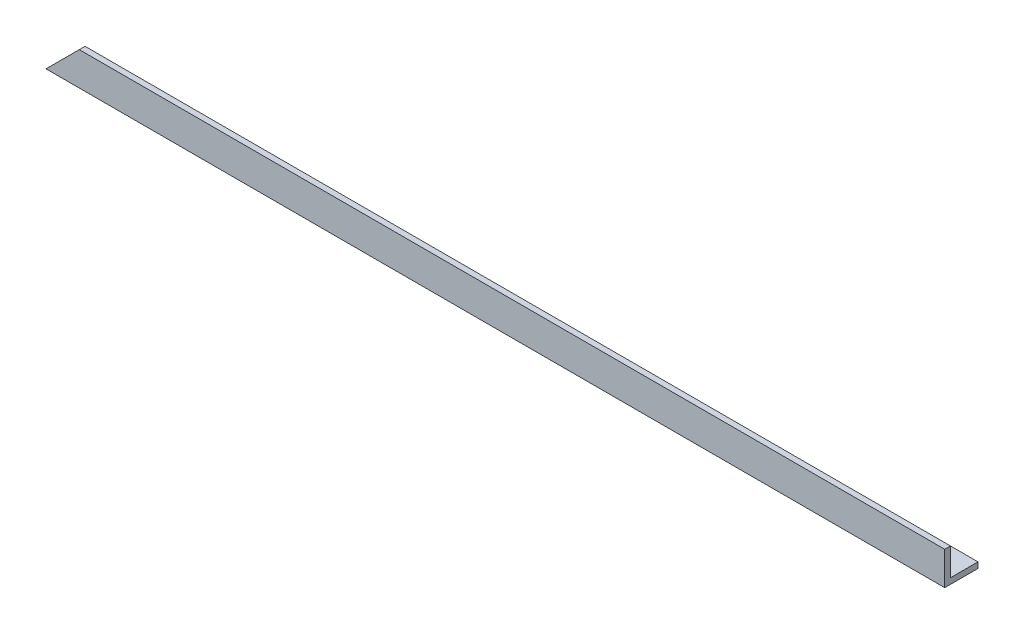
from build123d import *

# Parameters (mm, degrees)
BOSS_EXTRUDE1_DEPTH = 540
CUT_EXTRUDE1_DEPTH  = 541.740233384


with BuildPart() as part:
    # Sketch1 → Boss-Extrude1 (new body)
    with BuildSketch(Plane(origin=(0, 0, 0), x_dir=(0, 0, -1), z_dir=(1, 0, 0))):
        Polygon((0, 0), (20, 0), (20, 3.461178467), (3.461178467, 3.461178467), (3.461178467, 20), (0, 20), align=None)
    extrude(amount=BOSS_EXTRUDE1_DEPTH)

    # Sketch2 → Cut-Extrude1 (cut, through all)
    with BuildSketch(Plane(origin=(0, 0, 0), x_dir=(1, 0, 0), z_dir=(0, 0, -1))):
        Polygon((0, -20), (0, 0), (20, -20), align=None)
    extrude(amount=CUT_EXTRUDE1_DEPTH, mode=Mode.SUBTRACT)


solid = part.part
